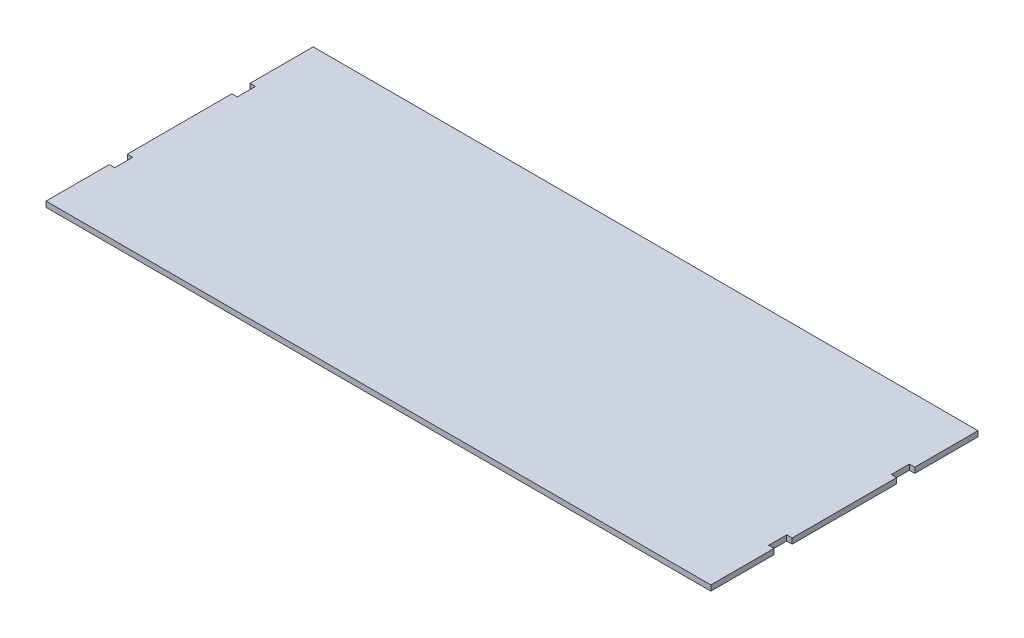
from build123d import *

# Parameters (mm, degrees)
BOSS_EXTRUDE1_DEPTH = 3


with BuildPart() as part:
    # Sketch1 → Boss-Extrude1 (new body)
    with BuildSketch(Plane(origin=(0, 0, 0), x_dir=(1, 0, 0), z_dir=(0, 1, 0))):
        Polygon((-184, 38.945), (-181, 38.945), (-181, 28.945), (-184, 28.945), (-184, -28.945), (-181, -28.945), (-181, -38.945), (-184, -38.945), (-184, -73.945), (184, -73.945), (184, -38.945), (181, -38.945), (181, -28.945), (184, -28.945), (184, 28.945), (181, 28.945), (181, 38.945), (184, 38.945), (184, 73.945), (-184, 73.945), align=None)
    extrude(amount=BOSS_EXTRUDE1_DEPTH)


solid = part.part
